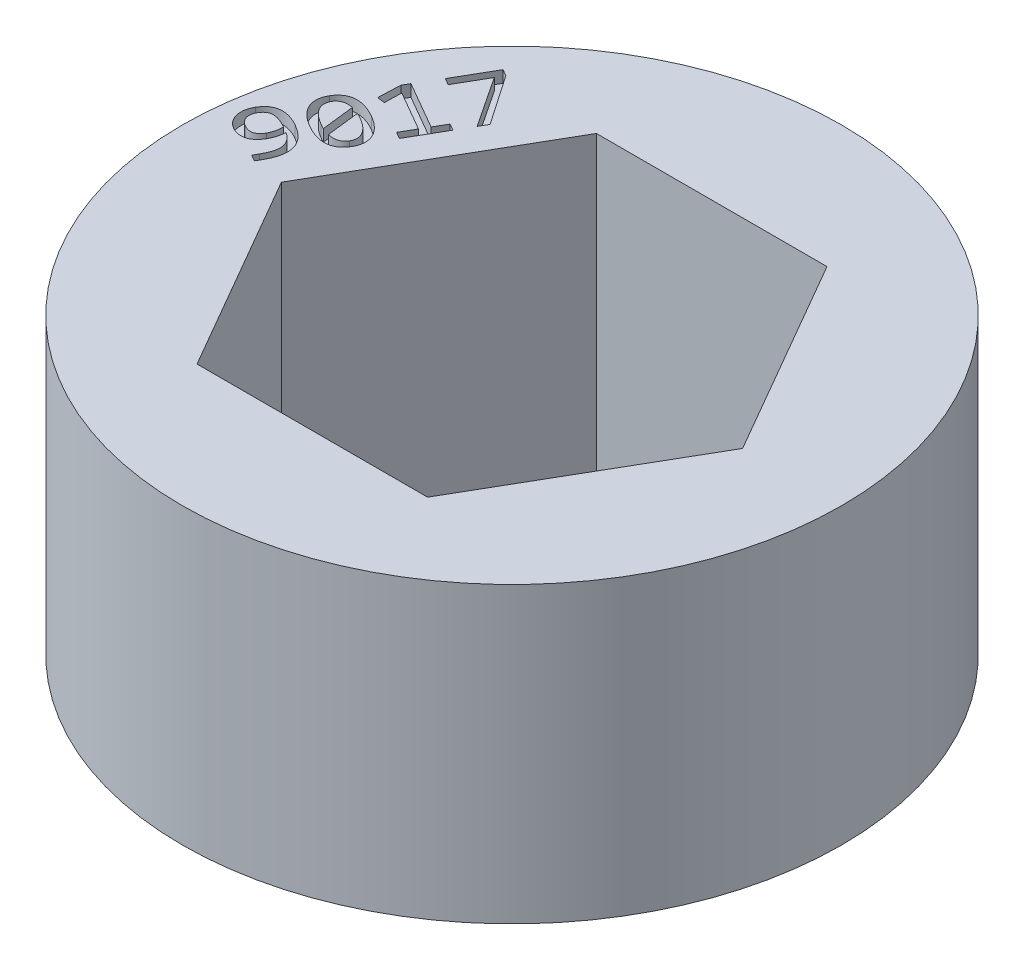
from build123d import *

# Parameters (mm, degrees)
SKETCH1_R           = 11.1125
BOSS_EXTRUDE1_DEPTH = 9.906
CUT_EXTRUDE1_DEPTH  = 0.4


with BuildPart() as part:
    # Sketch1 → Boss-Extrude1 (new body)
    with BuildSketch(Plane(origin=(0, 0, 0), x_dir=(1, 0, 0), z_dir=(0, 1, 0))):
        with Locations(Location((0, 0, 0), (0, 0, 270))):
            Circle(SKETCH1_R)
        Polygon((-3.886144662, 6.731), (-7.772289324, 0), (-3.886144662, -6.731), (3.886144662, -6.731), (7.772289324, 0), (3.886144662, 6.731), align=None, mode=Mode.SUBTRACT)
    extrude(amount=BOSS_EXTRUDE1_DEPTH)

    # Sketch2 → Cut-Extrude1 (cut)
    # profile 1 of 4: a face of its own
    with BuildSketch(Plane(origin=(0, 9.906, 0), x_dir=(1, 0, 0), z_dir=(0, 1, 0))):
        with BuildLine():
            add(Edge.make_bspline(
                [(-9.202304083, 1.896353401), (-9.159831196, 1.87085151), (-9.077892976, 1.821653547), (-8.965375575, 1.740555232), (-8.866461554, 1.657090041), (-8.78144551, 1.570584827), (-8.709906365, 1.48124931), (-8.651615353, 1.389257835), (-8.605568719, 1.294572134), (-8.57393047, 1.196545085), (-8.554000714, 1.096022886), (-8.54764874, 0.992659706), (-8.553505669, 0.886606425), (-8.572008487, 0.777873516), (-8.602362475, 0.66648234), (-8.644087778, 0.552100834), (-8.697248769, 0.434914269), (-8.739935492, 0.357772877), (-8.761841136, 0.318186052)],
                knots=[0, 0, 0, 0, 1.26107535, 2.432852479, 3.527493781, 4.553108896, 5.516392568, 6.436262581, 7.321020037, 8.189904331, 9.051915197, 9.923950707, 10.819638431, 11.750863291, 12.727159529, 13.755627168, 14.848250068, 16, 16, 16, 16], degree=3))
            Line((-8.761841136, 0.318186052), (-8.849174306, 0.166302277))
            Line((-8.849174306, 0.166302277), (-9.061336954, 0.288758571))
            Line((-9.061336954, 0.288758571), (-8.964036411, 0.457254634))
            add(Edge.make_bspline(
                [(-8.964036411, 0.457254634), (-8.94765815, 0.486475168), (-8.916081939, 0.542810438), (-8.876742625, 0.627847441), (-8.84446563, 0.708974578), (-8.82053244, 0.787097041), (-8.804330132, 0.861890505), (-8.794663573, 0.933496241), (-8.793888414, 1.002282817), (-8.799896224, 1.068191974), (-8.813198974, 1.131312527), (-8.833750965, 1.191318115), (-8.860957651, 1.248476381), (-8.895673034, 1.302190211), (-8.936051737, 1.353511947), (-8.982713811, 1.402325779), (-9.035304868, 1.448823703), (-9.073915446, 1.477075721), (-9.093612257, 1.491488214)],
                knots=[0, 0, 0, 0, 1.369866009, 2.64101171, 3.829683058, 4.939363019, 5.979057063, 6.957648105, 7.88973843, 8.786859828, 9.660202633, 10.521884088, 11.375874529, 12.243080261, 13.132605156, 14.043626903, 15.00197531, 16, 16, 16, 16], degree=3))
            Line((-9.093612257, 1.491488214), (-9.147720851, 1.530408431))
            add(Edge.make_bspline(
                [(-9.147720851, 1.530408431), (-9.148067924, 1.51045859), (-9.148774692, 1.469833337), (-9.155274715, 1.40816092), (-9.165731319, 1.344572057), (-9.180935522, 1.27940885), (-9.20073243, 1.213027698), (-9.225980479, 1.146355079), (-9.256998313, 1.079696939), (-9.281139983, 1.036170056), (-9.293434348, 1.014003596)],
                knots=[0, 0, 0, 0, 0.881892042, 1.795858346, 2.738918638, 3.729928991, 4.752438676, 5.799657364, 6.879455566, 8, 8, 8, 8], degree=3))
            add(Edge.make_bspline(
                [(-9.293434348, 1.014003596), (-9.306833984, 0.991928595), (-9.332850086, 0.949068814), (-9.376940997, 0.890372961), (-9.423176106, 0.838250081), (-9.472797223, 0.79398634), (-9.524217233, 0.756945653), (-9.576804263, 0.725993329), (-9.63115833, 0.702182815), (-9.686899192, 0.685015062), (-9.743764358, 0.674393988), (-9.801728972, 0.670914949), (-9.860566838, 0.672648373), (-9.920183485, 0.680904379), (-9.979796316, 0.695065504), (-10.039070276, 0.715623332), (-10.098485934, 0.740215736), (-10.136573677, 0.761278984), (-10.155849407, 0.77193883)],
                knots=[0, 0, 0, 0, 1.220818745, 2.37028402, 3.467196432, 4.511270901, 5.508233766, 6.460609138, 7.392176096, 8.308254501, 9.213880663, 10.121360086, 11.049795717, 11.99384344, 12.963121719, 13.942859105, 14.958906727, 16, 16, 16, 16], degree=3))
            add(Edge.make_bspline(
                [(-10.155849407, 0.77193883), (-10.176376695, 0.784505637), (-10.217002623, 0.809376834), (-10.272486361, 0.853383776), (-10.322814642, 0.90160946), (-10.367310309, 0.954144137), (-10.405776635, 1.010464856), (-10.438663876, 1.069118836), (-10.464977516, 1.130544868), (-10.485090307, 1.194271342), (-10.49805903, 1.260350582), (-10.505619117, 1.32817789), (-10.505058249, 1.397641275), (-10.499312212, 1.468589368), (-10.485340516, 1.539952972), (-10.464312824, 1.611391422), (-10.435462984, 1.682237493), (-10.410555955, 1.727610458), (-10.397914174, 1.750639904)],
                knots=[0, 0, 0, 0, 1.024955976, 2.028508958, 3.010840552, 3.9915742, 4.95660687, 5.913407423, 6.85275347, 7.799595412, 8.75563543, 9.718404202, 10.702816177, 11.711272339, 12.748003468, 13.795531558, 14.881102689, 16, 16, 16, 16], degree=3))
            add(Edge.make_bspline(
                [(-10.397914174, 1.750639904), (-10.384484727, 1.772375548), (-10.357995444, 1.815248617), (-10.313075321, 1.874826888), (-10.263026781, 1.927638613), (-10.210017418, 1.975670828), (-10.151989246, 2.016839355), (-10.088871048, 2.049728109), (-10.021184993, 2.074516303), (-9.949039293, 2.091621729), (-9.872125014, 2.10070826), (-9.790450392, 2.10037098), (-9.704157904, 2.091053643), (-9.613043851, 2.072623604), (-9.516807743, 2.0450999), (-9.415945875, 2.005936417), (-9.309829463, 1.956514259), (-9.23907506, 1.916926903), (-9.202304083, 1.896353401)],
                knots=[0, 0, 0, 0, 0.895775697, 1.766897478, 2.610861503, 3.44393995, 4.272126178, 5.098544862, 5.932380511, 6.793675459, 7.693172246, 8.641954431, 9.651738902, 10.732259887, 11.898328963, 13.157530098, 14.522771823, 16, 16, 16, 16], degree=3))
        make_face()
        with BuildLine():
            add(Edge.make_bspline(
                [(-10.205211634, 1.62391188), (-10.212258818, 1.611058515), (-10.226232129, 1.585572577), (-10.242640753, 1.54578601), (-10.255289769, 1.505635391), (-10.263121418, 1.465180455), (-10.267811583, 1.424843269), (-10.267023706, 1.384888385), (-10.262818154, 1.345450003), (-10.254454949, 1.306475698), (-10.240753531, 1.268518105), (-10.223826615, 1.231029819), (-10.201480765, 1.194941816), (-10.175679801, 1.159376196), (-10.145018366, 1.12544859), (-10.10963768, 1.093614744), (-10.06971099, 1.06366202), (-10.040667414, 1.045886244), (-10.025798925, 1.036786162)],
                knots=[0, 0, 0, 0, 1.016648463, 2.015833194, 2.981328839, 3.933116328, 4.871637838, 5.79402756, 6.699798663, 7.621600022, 8.552252544, 9.495515062, 10.470949164, 11.49215303, 12.541710463, 13.637792469, 14.790697928, 16, 16, 16, 16], degree=3))
            add(Edge.make_bspline(
                [(-10.025798925, 1.036786162), (-10.011820875, 1.028994975), (-9.98448052, 1.013755811), (-9.942912958, 0.994840728), (-9.90205132, 0.980035924), (-9.862355662, 0.96842537), (-9.8232572, 0.961008681), (-9.785179044, 0.958875984), (-9.748086468, 0.960076619), (-9.711916115, 0.965854481), (-9.676448324, 0.975800265), (-9.642007464, 0.990703108), (-9.6087651, 1.010447691), (-9.57607957, 1.034327181), (-9.54484031, 1.063428757), (-9.515000211, 1.097529511), (-9.485656784, 1.135858029), (-9.468756949, 1.164427361), (-9.460031864, 1.179177201)],
                knots=[0, 0, 0, 0, 1.148752821, 2.246902016, 3.274754531, 4.267217048, 5.21423037, 6.124838449, 7.000255556, 7.87434482, 8.74821258, 9.638757594, 10.560354224, 11.519217947, 12.540204387, 13.618548392, 14.770498666, 16, 16, 16, 16], degree=3))
            add(Edge.make_bspline(
                [(-9.460031864, 1.179177201), (-9.450497411, 1.196886433), (-9.430996243, 1.233107777), (-9.408135241, 1.291514358), (-9.387681674, 1.35174539), (-9.372069448, 1.413356375), (-9.360694528, 1.474574749), (-9.353815255, 1.534837703), (-9.349810885, 1.592713839), (-9.351482251, 1.630396836), (-9.352289311, 1.648592993)],
                knots=[0, 0, 0, 0, 0.989180975, 2.023208327, 3.08218561, 4.119170804, 5.148701278, 6.14463442, 7.104091302, 8, 8, 8, 8], degree=3))
            add(Edge.make_bspline(
                [(-9.352289311, 1.648592993), (-9.381285805, 1.664782384), (-9.436848013, 1.695804007), (-9.518419746, 1.737016091), (-9.594867106, 1.769888847), (-9.66607766, 1.795336678), (-9.732159172, 1.814175982), (-9.794079719, 1.826346228), (-9.851781167, 1.832235874), (-9.905607039, 1.831985841), (-9.955316218, 1.825599839), (-10.001095707, 1.812506189), (-10.043249194, 1.794036689), (-10.081629159, 1.76944764), (-10.116295585, 1.739487009), (-10.148838663, 1.705577079), (-10.178951173, 1.666943436), (-10.196312561, 1.638494295), (-10.205211634, 1.62391188)],
                knots=[0, 0, 0, 0, 1.641980165, 3.146312877, 4.516570665, 5.753706229, 6.883060353, 7.910973248, 8.869956537, 9.746141466, 10.567047688, 11.339642561, 12.09262207, 12.834796225, 13.584027923, 14.353089963, 15.155829459, 16, 16, 16, 16], degree=3))
        make_face(mode=Mode.SUBTRACT)
    # profile 2 of 4: a face of its own
    with BuildSketch(Plane(origin=(0, 9.906, 0), x_dir=(1, 0, 0), z_dir=(0, 1, 0))):
        with BuildLine():
            add(Edge.make_bspline(
                [(-8.172816871, 3.440400024), (-8.139047221, 3.420195787), (-8.072959664, 3.380655883), (-7.97968433, 3.31640313), (-7.894157152, 3.249436256), (-7.816091138, 3.180384199), (-7.74659411, 3.108774364), (-7.686164065, 3.035069621), (-7.634157299, 2.95986672), (-7.59233337, 2.882274679), (-7.559757295, 2.803293154), (-7.536914029, 2.722910129), (-7.525382037, 2.641196929), (-7.522571263, 2.558495692), (-7.531302154, 2.474827597), (-7.55155277, 2.390607362), (-7.583680941, 2.305858515), (-7.612894595, 2.251443968), (-7.627933829, 2.223431277)],
                knots=[0, 0, 0, 0, 1.255744011, 2.457504125, 3.61208477, 4.720825249, 5.781434268, 6.793285669, 7.759690144, 8.69505635, 9.600883533, 10.481779685, 11.354431227, 12.228367454, 13.116700136, 14.030374979, 14.986034071, 16, 16, 16, 16], degree=3))
            add(Edge.make_bspline(
                [(-7.627933829, 2.223431277), (-7.642303487, 2.199987584), (-7.670566434, 2.153877378), (-7.720964052, 2.091627836), (-7.775758194, 2.036026565), (-7.835522981, 1.987770606), (-7.900854196, 1.948065512), (-7.970887338, 1.91642469), (-8.046143662, 1.894244318), (-8.12591757, 1.880440496), (-8.210642152, 1.87577177), (-8.300281058, 1.881065496), (-8.395010725, 1.894821365), (-8.494494467, 1.919001847), (-8.598733181, 1.953175743), (-8.708112627, 1.996922859), (-8.822000102, 2.051817942), (-8.89812032, 2.094240682), (-8.93745675, 2.116163361)],
                knots=[0, 0, 0, 0, 0.887514945, 1.7456079, 2.580477532, 3.405843249, 4.220184053, 5.043775402, 5.881409691, 6.747743824, 7.653857936, 8.616110277, 9.643970182, 10.742341741, 11.91903629, 13.185155048, 14.545380523, 16, 16, 16, 16], degree=3))
            add(Edge.make_bspline(
                [(-8.93745675, 2.116163361), (-8.971233434, 2.136357179), (-9.037523674, 2.175989637), (-9.130870242, 2.240531686), (-9.216753748, 2.307747705), (-9.295141976, 2.37697045), (-9.364459995, 2.449210578), (-9.425134107, 2.522867523), (-9.47683128, 2.598181736), (-9.519448508, 2.67508469), (-9.552096321, 2.754017692), (-9.574647192, 2.83431584), (-9.586387391, 2.91614721), (-9.589118539, 2.998861287), (-9.580402817, 3.082684823), (-9.56013978, 3.166903977), (-9.528155309, 3.251328207), (-9.499109773, 3.30543117), (-9.48423834, 3.333132108)],
                knots=[0, 0, 0, 0, 1.255373441, 2.463800411, 3.618040339, 4.733580732, 5.797511645, 6.809064448, 7.775183738, 8.708255107, 9.609145698, 10.494644339, 11.362043712, 12.240768002, 13.128838537, 14.042243755, 14.997620833, 16, 16, 16, 16], degree=3))
            add(Edge.make_bspline(
                [(-9.48423834, 3.333132108), (-9.469894741, 3.35675294), (-9.441749942, 3.403101391), (-9.391163111, 3.465358418), (-9.336601677, 3.521100001), (-9.276320336, 3.568624512), (-9.211612499, 3.609203307), (-9.141130099, 3.639965545), (-9.065908469, 3.662434281), (-8.985765149, 3.676105525), (-8.900589194, 3.680758792), (-8.810579772, 3.675670792), (-8.715772733, 3.661133769), (-8.616208219, 3.636924414), (-8.511565922, 3.603633432), (-8.402181625, 3.559578868), (-8.288267778, 3.504762603), (-8.212151345, 3.46232855), (-8.172816871, 3.440400024)],
                knots=[0, 0, 0, 0, 0.890647466, 1.747615399, 2.581390456, 3.402491149, 4.218435044, 5.038869091, 5.875405182, 6.745633098, 7.655655584, 8.621743612, 9.649004423, 10.745935938, 11.924386729, 13.188845514, 14.547287634, 16, 16, 16, 16], degree=3))
        make_face()
        with BuildLine():
            add(Edge.make_bspline(
                [(-8.306664448, 3.190266432), (-8.322402643, 3.199125813), (-8.353866944, 3.216837769), (-8.402297238, 3.240442658), (-8.450155006, 3.263864762), (-8.482098054, 3.27875628), (-8.497943077, 3.286143065)],
                knots=[0, 0, 0, 0, 1.012394507, 2.024011446, 3.019831004, 4, 4, 4, 4], degree=3))
            Line((-8.497943077, 3.286143065), (-8.370265779, 2.184036423))
            add(Edge.make_bspline(
                [(-8.370265779, 2.184036423), (-8.342521848, 2.17790021), (-8.288378322, 2.165925114), (-8.207323226, 2.158400891), (-8.129748608, 2.159862851), (-8.056341328, 2.174293519), (-7.988445558, 2.2004437), (-7.936840923, 2.232066837), (-7.899586895, 2.263541242), (-7.873447916, 2.291322527), (-7.8490413, 2.32275498), (-7.834967742, 2.345895445), (-7.82775592, 2.357753491)],
                knots=[0, 0, 0, 0, 1.381161052, 2.695397824, 3.950564718, 5.143045676, 6.31510786, 7.472828931, 8.068075012, 8.683288839, 9.325267577, 10, 10, 10, 10], degree=3))
            add(Edge.make_bspline(
                [(-7.82775592, 2.357753491), (-7.819170802, 2.373502202), (-7.802259642, 2.404524371), (-7.786073081, 2.454575371), (-7.775706411, 2.5052051), (-7.772939482, 2.557003801), (-7.777345159, 2.609499392), (-7.788738591, 2.662556623), (-7.808249125, 2.71561468), (-7.834670325, 2.768947121), (-7.867863265, 2.822768276), (-7.909401364, 2.875899741), (-7.957218082, 2.929568391), (-8.012757199, 2.982832518), (-8.075456466, 3.035806671), (-8.145346133, 3.088625256), (-8.22310403, 3.140327735), (-8.27820029, 3.173255232), (-8.306664448, 3.190266432)],
                knots=[0, 0, 0, 0, 0.802555296, 1.58089168, 2.347373209, 3.114609231, 3.897457373, 4.702984933, 5.539880506, 6.424927666, 7.367776437, 8.369386388, 9.444406406, 10.588134339, 11.816039808, 13.122595673, 14.513458262, 16, 16, 16, 16], degree=3))
        make_face(mode=Mode.SUBTRACT)
        with BuildLine():
            add(Edge.make_bspline(
                [(-8.804558447, 2.366296953), (-8.790151061, 2.358086832), (-8.761336288, 2.34166659), (-8.718373972, 2.316777248), (-8.675143148, 2.293346022), (-8.645479752, 2.279902357), (-8.63084138, 2.273268141)],
                knots=[0, 0, 0, 0, 1.009220955, 2.01844191, 3.02213537, 4, 4, 4, 4], degree=3))
            Line((-8.63084138, 2.273268141), (-8.756145494, 3.373950872))
            add(Edge.make_bspline(
                [(-8.756145494, 3.373950872), (-8.783255769, 3.379825308), (-8.835986304, 3.391251312), (-8.914897396, 3.397122878), (-8.990385923, 3.394710751), (-9.061753261, 3.379763148), (-9.128443246, 3.354115699), (-9.178880859, 3.322416099), (-9.214642694, 3.290472231), (-9.240887009, 3.264017609), (-9.263725174, 3.232802054), (-9.277745591, 3.210599652), (-9.284890886, 3.199284531)],
                knots=[0, 0, 0, 0, 1.381152135, 2.686394368, 3.933623606, 5.133817521, 6.302454325, 7.479469322, 8.077411992, 8.690909568, 9.332841689, 10, 10, 10, 10], degree=3))
            add(Edge.make_bspline(
                [(-9.284890886, 3.199284531), (-9.293229983, 3.183499908), (-9.309712521, 3.152301007), (-9.326732889, 3.102576261), (-9.336904902, 3.051814104), (-9.339680947, 3.000046718), (-9.335445791, 2.947472665), (-9.323302787, 2.894535176), (-9.303802051, 2.841346834), (-9.277875663, 2.787606801), (-9.243376939, 2.734371902), (-9.202733248, 2.680483273), (-9.153597585, 2.627674288), (-9.098714445, 2.573644438), (-9.035717982, 2.520803095), (-8.965890945, 2.467924552), (-8.888114935, 2.416239413), (-8.833021266, 2.383309435), (-8.804558447, 2.366296953)],
                knots=[0, 0, 0, 0, 0.798642705, 1.578547341, 2.344318863, 3.110844177, 3.892967151, 4.6992759, 5.535396239, 6.425989978, 7.365723583, 8.372035659, 9.445545405, 10.593147466, 11.8199155, 13.125261074, 14.514835277, 16, 16, 16, 16], degree=3))
        make_face(mode=Mode.SUBTRACT)
    # profile 3 of 4: a face of its own
    with BuildSketch(Plane(origin=(0, 9.906, 0), x_dir=(1, 0, 0), z_dir=(0, 1, 0))):
        Polygon((-6.399099162, 4.409661486), (-7.06026822, 3.264837533), (-7.286195335, 3.395362652), (-7.015652361, 3.86382917), (-8.345584665, 4.631791507), (-8.360773043, 4.058904893), (-8.61897546, 4.088807012), (-8.589073342, 4.845378065), (-8.465193138, 5.059913897), (-6.860446129, 4.132948234), (-6.625026278, 4.540186605), align=None)
    # profile 4 of 4: a face of its own
    with BuildSketch(Plane(origin=(0, 9.906, 0), x_dir=(1, 0, 0), z_dir=(0, 1, 0))):
        Polygon((-7.096340617, 6.888742598), (-5.941074654, 5.203307334), (-6.101501891, 4.925644808), (-7.239206292, 6.640982191), (-7.807821175, 5.656585474), (-8.03374829, 5.787110593), (-7.322267732, 7.019267717), align=None)
    extrude(amount=-CUT_EXTRUDE1_DEPTH, mode=Mode.SUBTRACT)


solid = part.part
